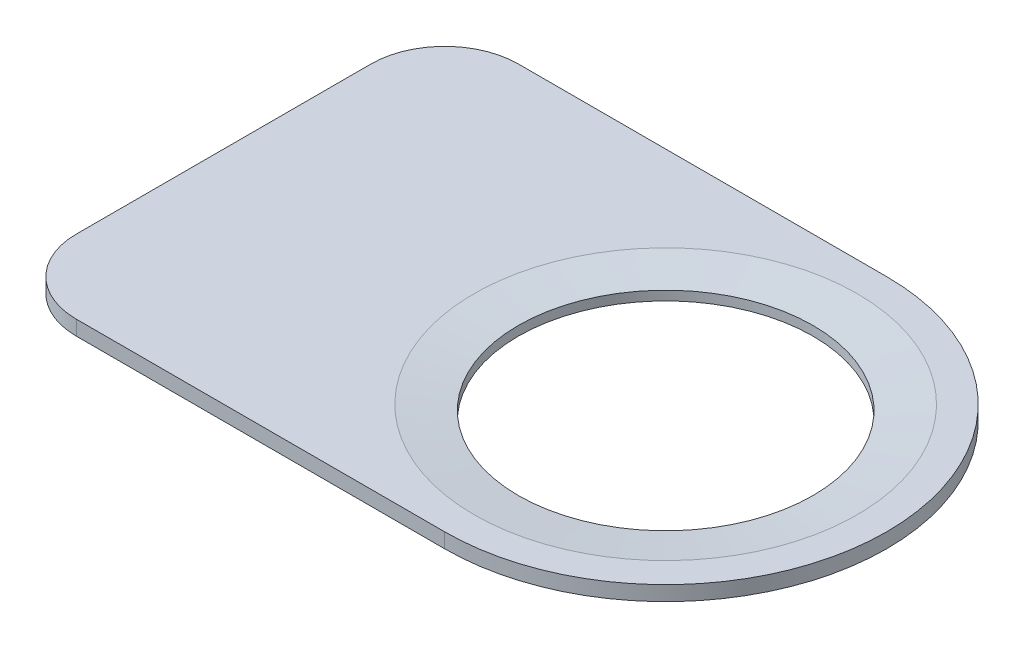
from build123d import *

# Parameters (mm, degrees)
SKETCH1_R           = 10
BOSS_EXTRUDE1_DEPTH = 1
CHAMFER1_SIZE       = 3
CHAMFER1_SIZE2      = 0.368353683


with BuildPart() as part:
    # Sketch1 → Boss-Extrude1 (new body)
    with BuildSketch(Plane(origin=(0, 0, 0), x_dir=(1, 0, 0), z_dir=(0, 1, 0))):
        with BuildLine():
            Line((0, 15), (-25, 15))
            ThreePointArc((-25, 15), (-28.535533906, 13.535533906), (-30, 10))
            Line((-30, 10), (-30, -10))
            ThreePointArc((-30, -10), (-28.535533906, -13.535533906), (-25, -15))
            Line((-25, -15), (0, -15))
            ThreePointArc((0, -15), (15, 0), (0, 15))
        make_face()
        with Locations(Location((0, 0, 0), (0, 0, 270))):
            Circle(SKETCH1_R, mode=Mode.SUBTRACT)
    extrude(amount=BOSS_EXTRUDE1_DEPTH)

    # Chamfer1
    chamfer1_edges = [part.edges().sort_by_distance(p)[0] for p in [
        (0, 1, -10),
    ]]
    chamfer1_side = [part.faces().sort_by_distance(p)[0] for p in [
        (-11.782026839, 1, 0),
    ]]
    chamfer(chamfer1_edges, length=CHAMFER1_SIZE, length2=CHAMFER1_SIZE2, reference=chamfer1_side[0])


solid = part.part
